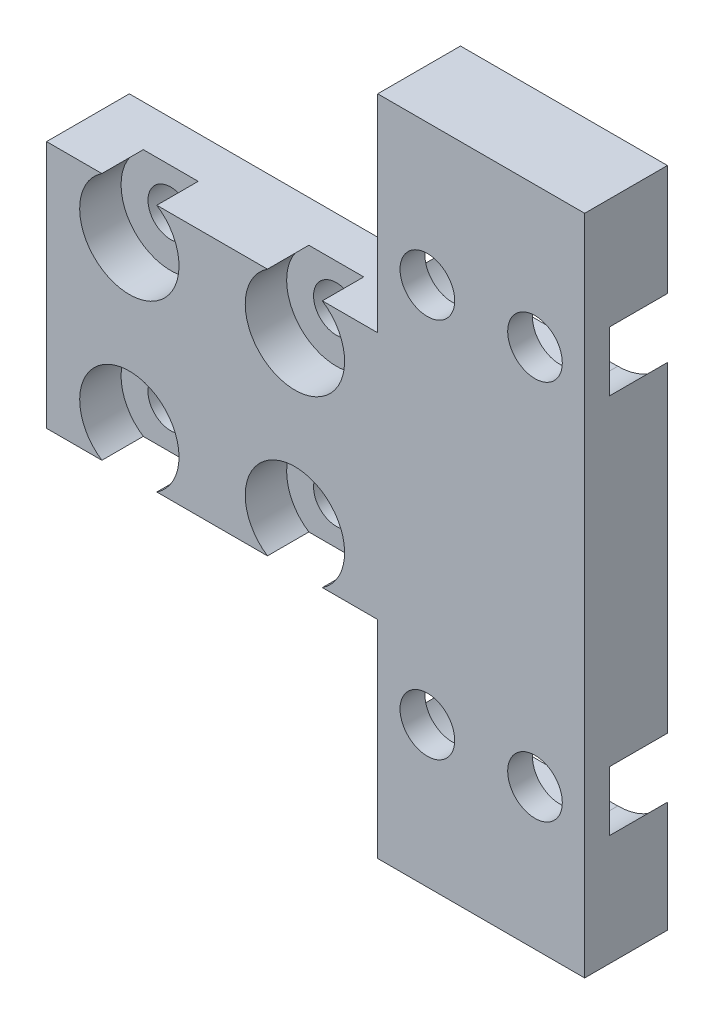
from build123d import *

# Parameters (mm, degrees)
ESQUISSE1_R             = 3.3
ESQUISSE1_R_2           = 2.75
BOSS_EXTRU_1_DEPTH      = 10
ESQUISSE2_R             = 6
ENL_V_MAT_EXTRU_1_DEPTH = 5
ENL_V_MAT_EXTRU_3_DEPTH = 7


with BuildPart() as part:
    # Esquisse1 → Boss.-Extru.1 (new body)
    with BuildSketch(Plane.XY):
        Polygon((6.821863894, 43.038413396), (6.821863894, -36.961586604), (-18.178136106, -36.961586604), (-18.178136106, -11.961586604), (-58.178136106, -11.961586604), (-58.178136106, 18.038413396), (-18.178136106, 18.038413396), (-18.178136106, 43.038413396), align=None)
        with Locations((0.821863894, 26.038413396)):
            Circle(ESQUISSE1_R, mode=Mode.SUBTRACT)
        with Locations((-12.178136106, 26.038413396)):
            Circle(ESQUISSE1_R, mode=Mode.SUBTRACT)
        with Locations((-12.178136106, -19.961586604)):
            Circle(ESQUISSE1_R, mode=Mode.SUBTRACT)
        with Locations((0.821863894, -19.961586604)):
            Circle(ESQUISSE1_R, mode=Mode.SUBTRACT)
        with Locations((-48.178136106, 13.038413396)):
            Circle(ESQUISSE1_R_2, mode=Mode.SUBTRACT)
        with Locations((-28.178136106, 13.038413396)):
            Circle(ESQUISSE1_R_2, mode=Mode.SUBTRACT)
        with Locations((-28.178136106, -6.961586604)):
            Circle(ESQUISSE1_R_2, mode=Mode.SUBTRACT)
        with Locations((-48.178136106, -6.961586604)):
            Circle(ESQUISSE1_R_2, mode=Mode.SUBTRACT)
    extrude(amount=BOSS_EXTRU_1_DEPTH)

    # Esquisse2 → Enlèv. mat.-Extru.1 (cut)
    with BuildSketch(Plane.XY.offset(10)):
        with Locations((-48.178136106, 13.038413396)):
            Circle(ESQUISSE2_R)
        with Locations((-28.178136106, 13.038413396)):
            Circle(ESQUISSE2_R)
        with Locations((-28.178136106, -6.961586604)):
            Circle(ESQUISSE2_R)
        with Locations((-48.178136106, -6.961586604)):
            Circle(ESQUISSE2_R)
    extrude(amount=-ENL_V_MAT_EXTRU_1_DEPTH, mode=Mode.SUBTRACT)

    # Esquisse3 → Enlèv. mat.-Extru.3 (cut)
    with BuildSketch(Plane(origin=(0, 0, 0), x_dir=(-1, 0, 0), z_dir=(0, 0, -1))):
        with BuildLine():
            Line((-0.821863894, 33.038413396), (12.178136106, 33.038413396))
            ThreePointArc((12.178136106, 33.038413396), (19.178136106, 26.038413396), (12.178136106, 19.038413396))
            Line((12.178136106, 19.038413396), (-0.821863894, 19.038413396))
            ThreePointArc((-0.821863894, 19.038413396), (-7.821863894, 26.038413396), (-0.821863894, 33.038413396))
        make_face()
        with BuildLine():
            Line((-0.821863894, -12.961586604), (12.178136106, -12.961586604))
            ThreePointArc((12.178136106, -12.961586604), (19.178136106, -19.961586604), (12.178136106, -26.961586604))
            Line((12.178136106, -26.961586604), (-0.821863894, -26.961586604))
            ThreePointArc((-0.821863894, -26.961586604), (-7.821863894, -19.961586604), (-0.821863894, -12.961586604))
        make_face()
    extrude(amount=-ENL_V_MAT_EXTRU_3_DEPTH, mode=Mode.SUBTRACT)


solid = part.part
